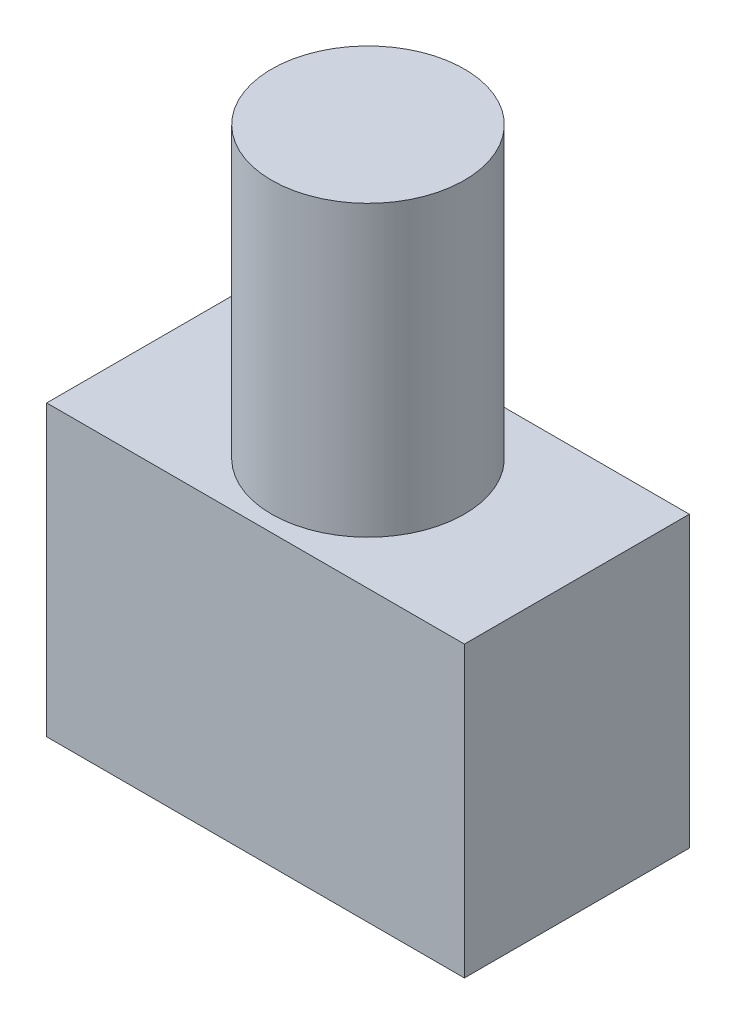
from build123d import *

# Parameters (mm, degrees)
SKETCH1_W           = 13
SKETCH1_H           = 7
BOSS_EXTRUDE1_DEPTH = 9
SKETCH2_R           = 3
BOSS_EXTRUDE2_DEPTH = 9


with BuildPart() as part:
    # Sketch1 → Boss-Extrude1 (new body)
    with BuildSketch(Plane(origin=(0, 0, 0), x_dir=(1, 0, 0), z_dir=(0, 1, 0))):
        Rectangle(SKETCH1_W, SKETCH1_H)
    extrude(amount=BOSS_EXTRUDE1_DEPTH)

    # Sketch2 → Boss-Extrude2 (add)
    with BuildSketch(Plane(origin=(0, 9, 0), x_dir=(1, 0, 0), z_dir=(0, 1, 0))):
        with Locations(Location((0, 0, 0), (0, 0, 270))):
            Circle(SKETCH2_R)
    extrude(amount=BOSS_EXTRUDE2_DEPTH)


solid = part.part
